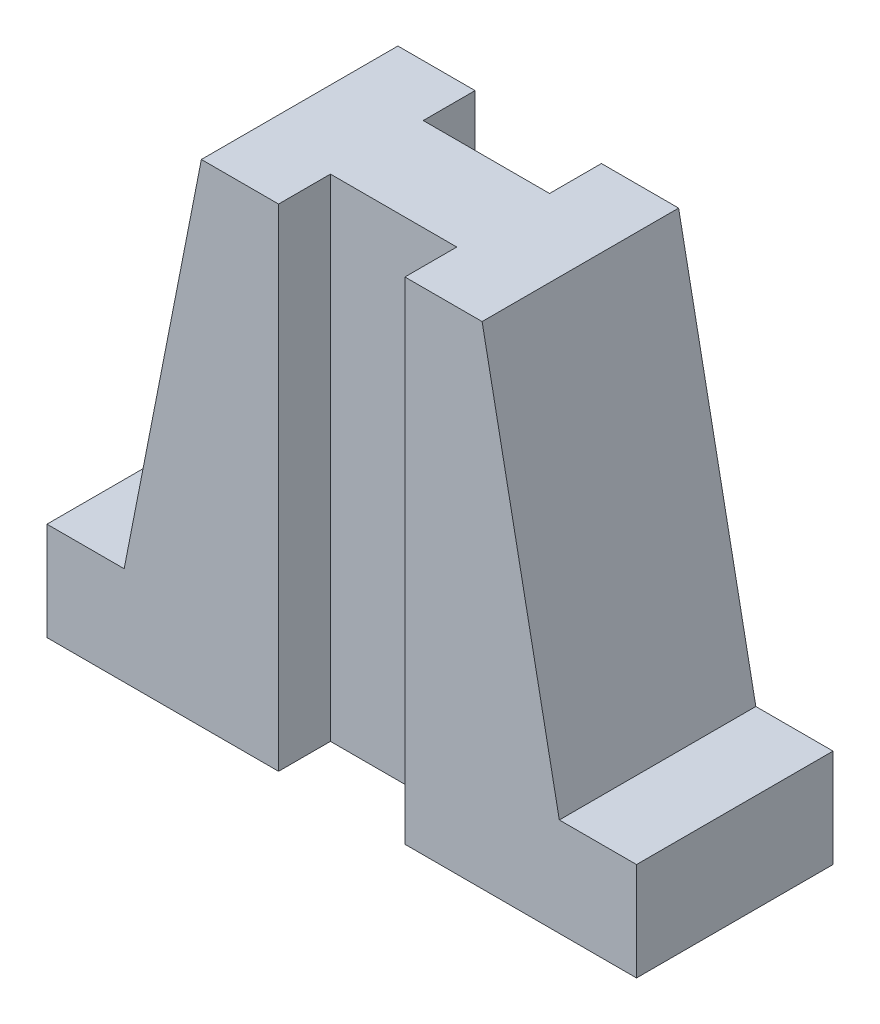
from build123d import *

# Parameters (mm, degrees)
SALIENTE_EXTRUIR1_DEPTH = 14
CROQUIS3_W              = 18
CROQUIS3_H              = 7.391109276
CORTAR_EXTRUIR1_DEPTH   = 83.825116963


with BuildPart() as part:
    # Croquis1 → Saliente-Extruir1 (new, symmetric)
    with BuildSketch(Plane.XY):
        Polygon((42, 0), (-42, 0), (-42, 14), (-31, 14), (-20, 70), (20, 70), (31, 14), (42, 14), align=None)
    extrude(amount=SALIENTE_EXTRUIR1_DEPTH, both=True)

    # Croquis3 → Cortar-Extruir1 (cut, through all)
    with BuildSketch(Plane(origin=(0, 70, 0), x_dir=(1, 0, 0), z_dir=(0, 1, 0))):
        with Locations((0, 10.304445362)):
            Rectangle(CROQUIS3_W, CROQUIS3_H)
        with Locations((0, -10.304445362)):
            Rectangle(CROQUIS3_W, CROQUIS3_H)
    extrude(amount=-CORTAR_EXTRUIR1_DEPTH, mode=Mode.SUBTRACT)


solid = part.part
